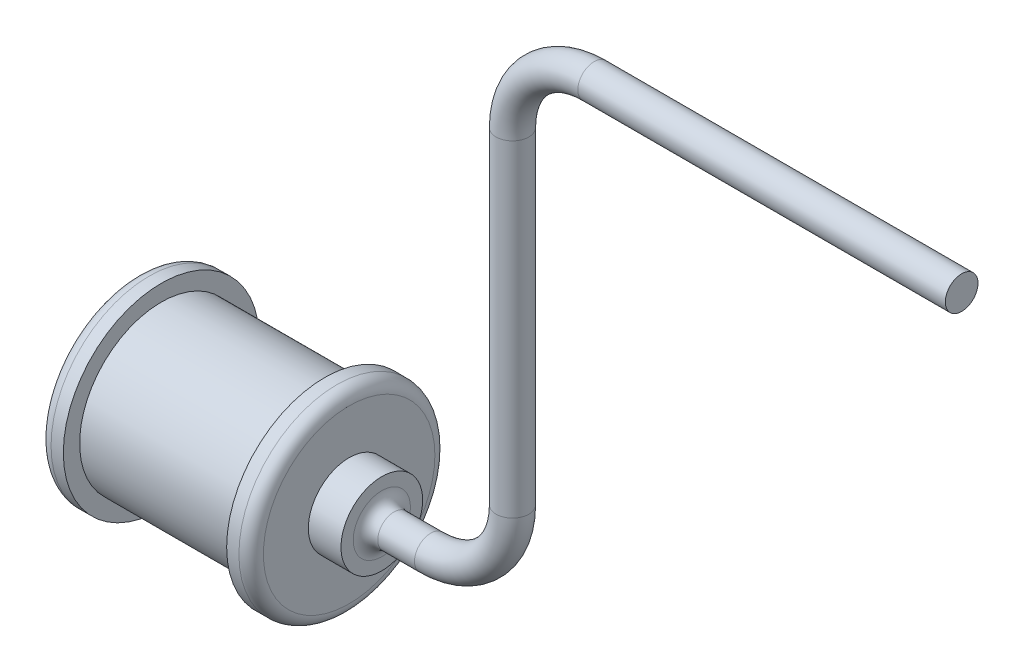
from build123d import *

# Parameters (mm, degrees)
SKETCH2_R           = 15.24
BOSS_EXTRUDE1_DEPTH = 3.81
SKETCH3_R           = 12.7
BOSS_EXTRUDE2_DEPTH = 25.4
SKETCH4_R           = 15.24
BOSS_EXTRUDE3_DEPTH = 3.81
SKETCH6_R           = 2.54
FILLET1_R           = 1.905
SKETCH7_R           = 6.35
BOSS_EXTRUDE4_DEPTH = 5.08
BOSS_EXTRUDE5_START = 5.08
SKETCH8_R           = 6.35
BOSS_EXTRUDE5_DEPTH = 5.08
FILLET2_R           = 1.905


with BuildPart() as part:
    # Sketch2 → Boss-Extrude1 (new body)
    with BuildSketch(Plane(origin=(0, 0, 0), x_dir=(0, 0, -1), z_dir=(1, 0, 0))):
        with Locations(Location((0, 0, 0), (0, 0, 180))):
            Circle(SKETCH2_R)
    extrude(amount=BOSS_EXTRUDE1_DEPTH)

    # Sketch3 → Boss-Extrude2 (add)
    with BuildSketch(Plane(origin=(3.81, 0, 0), x_dir=(0, 0, -1), z_dir=(1, 0, 0))):
        Circle(SKETCH3_R)
    extrude(amount=BOSS_EXTRUDE2_DEPTH)

    # Sketch4 → Boss-Extrude3 (add)
    with BuildSketch(Plane(origin=(29.21, 0, 0), x_dir=(0, 0, -1), z_dir=(1, 0, 0))):
        with Locations(Location((0, 0, 0), (0, 0, 180))):
            Circle(SKETCH4_R)
    extrude(amount=BOSS_EXTRUDE3_DEPTH)

    # Sweep1: sweep along a path in Sketch5
    with BuildLine(Plane.XY) as sweep1_path:
        Line((33.02, 0), (45.72, 0))
        ThreePointArc((45.72, 0), (54.700256121, 3.719743879), (58.42, 12.7))
        Line((58.42, 12.7), (58.42, 63.5))
        ThreePointArc((58.42, 63.5), (62.139743879, 72.480256121), (71.12, 76.2))
        Line((71.12, 76.2), (128.27, 76.2))
    # Sketch6 → Sweep1 (sweep)
    with BuildSketch(Plane(origin=(33.02, 0, 0), x_dir=(0, 0, -1), z_dir=(1, 0, 0))):
        Circle(SKETCH6_R)
    sweep(path=sweep1_path.line)

    # Fillet1
    fillet1_edges = [part.edges().sort_by_distance(p)[0] for p in [
        (33.02, 0, -15.24),
        (0, 0, -15.24),
    ]]
    fillet(fillet1_edges, radius=FILLET1_R)

    # Sketch7 → Boss-Extrude4 (add)
    with BuildSketch(Plane.ZY):
        with Locations(Location((0, 0, 0), (0, 0, 180))):
            Circle(SKETCH7_R)
    extrude(amount=BOSS_EXTRUDE4_DEPTH)

    # Sketch8 → Boss-Extrude5 (add)
    with BuildSketch(Plane(origin=(33.02, 0, 0), x_dir=(0, 0, -1), z_dir=(1, 0, 0)).offset(BOSS_EXTRUDE5_START)):
        Circle(SKETCH8_R)
    extrude(amount=-BOSS_EXTRUDE5_DEPTH)

    # Fillet2
    fillet2_edges = [part.edges().sort_by_distance(p)[0] for p in [
        (38.1, 0, 2.54),
    ]]
    fillet(fillet2_edges, radius=FILLET2_R)


solid = part.part
